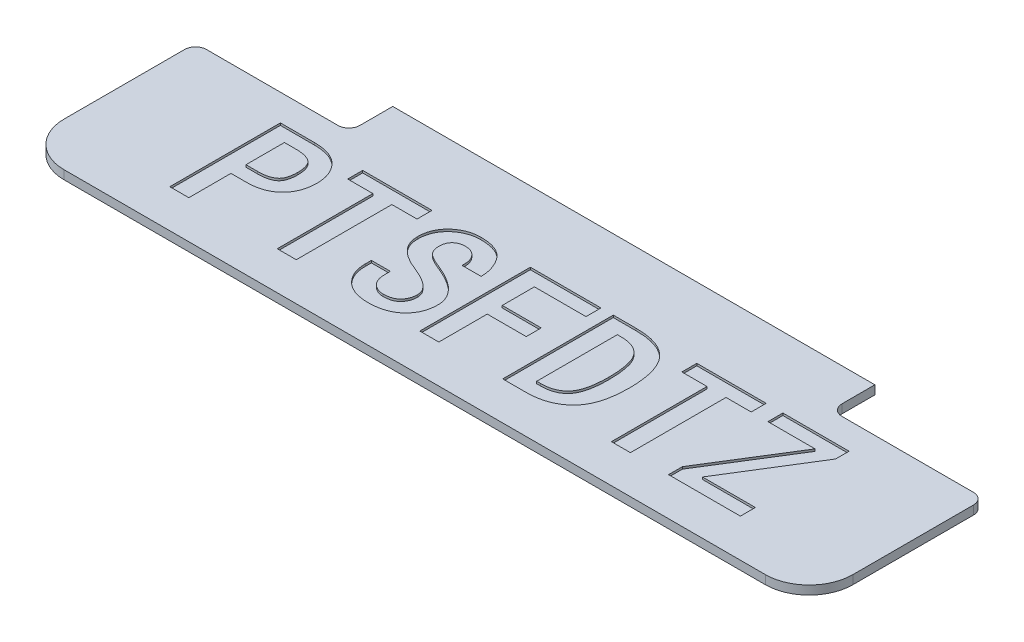
from build123d import *

# Parameters (mm, degrees)
SKETCH_1_W          = 360
SKETCH_1_H          = 100
EXTRUDE_1_DEPTH     = 4
FILLET_3_R          = 20
SKETCH_4_W          = 70
SKETCH_4_H          = 20
CUT_EXTRUDE_2_DEPTH = 6
FILLET_5_R          = 5
CUT_EXTRUDE_3_DEPTH = 1


with BuildPart() as part:
    # 草图1 → 凸台-拉伸1 (new body)
    with BuildSketch(Plane(origin=(0, 0, 0), x_dir=(1, 0, 0), z_dir=(0, 1, 0))):
        Rectangle(SKETCH_1_W, SKETCH_1_H)
    extrude(amount=EXTRUDE_1_DEPTH)

    # 圆角3
    fillet_3_edges = [part.edges().sort_by_distance(p)[0] for p in [
        (180, 2, 50),
        (-180, 2, 50),
    ]]
    fillet(fillet_3_edges, radius=FILLET_3_R)

    # 草图4 → 切除-拉伸2 (cut)
    with BuildSketch(Plane(origin=(0, 4, 0), x_dir=(1, 0, 0), z_dir=(0, 1, 0))):
        with Locations((-145, 40)):
            Rectangle(SKETCH_4_W, SKETCH_4_H)
        with Locations((145, 40)):
            Rectangle(SKETCH_4_W, SKETCH_4_H)
    extrude(amount=-CUT_EXTRUDE_2_DEPTH, mode=Mode.SUBTRACT)

    # 圆角5
    fillet_5_edges = [part.edges().sort_by_distance(p)[0] for p in [
        (-180, 2, -30),
        (-110, 2, -30),
        (180, 2, -30),
        (110, 2, -30),
    ]]
    fillet(fillet_5_edges, radius=FILLET_5_R)

    # 草图5 → 切除-拉伸3 (cut)
    # profile 1 of 7: a face of its own
    with BuildSketch(Plane(origin=(0, 4, 0), x_dir=(1, 0, 0), z_dir=(0, 1, 0))):
        with BuildLine():
            add(Edge.make_bspline(
                [(-96.930323036, 2.246131172), (-96.941240629, 1.678684399), (-96.96266472, 0.565157745), (-97.176776831, -1.061394982), (-97.505462245, -2.608479804), (-97.98565937, -4.066112037), (-98.596740714, -5.440103135), (-99.332362717, -6.737618495), (-100.219971253, -7.946795483), (-101.234618973, -9.069444095), (-102.368729992, -10.089994066), (-103.625112767, -10.975780061), (-105.002393633, -11.713498841), (-106.491977603, -12.317723659), (-108.090281346, -12.797421108), (-109.803032757, -13.125823637), (-111.624251111, -13.33843239), (-112.878002094, -13.359342717), (-113.521182902, -13.370069824)],
                knots=[0, 0, 0, 0, 1.055941234, 2.072121589, 3.048957332, 3.996857081, 4.923552649, 5.844699312, 6.768221172, 7.710385292, 8.657546142, 9.602916946, 10.565193964, 11.559900134, 12.591170482, 13.666713964, 14.803012066, 16, 16, 16, 16], degree=3))
            Line((-113.521182902, -13.370069824), (-120.462919961, -13.370069824))
            Line((-120.462919961, -13.370069824), (-120.462919961, -32.592508637))
            Line((-120.462919961, -32.592508637), (-129.137383898, -32.592508637))
            Line((-129.137383898, -32.592508637), (-129.137383898, 17.862332169))
            Line((-129.137383898, 17.862332169), (-113.521182902, 17.862332169))
            add(Edge.make_bspline(
                [(-113.521182902, 17.862332169), (-112.878003272, 17.851599948), (-111.624254585, 17.830679652), (-109.803019969, 17.618141502), (-108.09032574, 17.289490706), (-106.495026175, 16.811623682), (-105.007492565, 16.205379927), (-103.638895039, 15.455481786), (-102.379093591, 14.572185043), (-101.245782364, 13.550553913), (-100.229942247, 12.428757076), (-99.345164183, 11.215836106), (-98.594528876, 9.924880554), (-97.986491053, 8.547075866), (-97.50514227, 7.090054296), (-97.177954655, 5.546253541), (-96.961981277, 3.923602488), (-96.941032746, 2.81360526), (-96.930323036, 2.246131172)],
                knots=[0, 0, 0, 0, 1.197461093, 2.334208364, 3.410176999, 4.441854999, 5.43073401, 6.396602736, 7.342347237, 8.289882492, 9.232419041, 10.156305961, 11.081170954, 12.008232837, 12.956507283, 13.93372916, 14.943641362, 16, 16, 16, 16], degree=3))
        make_face()
        with BuildLine():
            add(Edge.make_bspline(
                [(-105.604786974, 2.246131172), (-105.608479009, 2.654402128), (-105.615586774, 3.440389753), (-105.74000997, 4.565658318), (-105.921952585, 5.590312848), (-106.163632167, 6.520265524), (-106.498542772, 7.346972328), (-106.911355072, 8.067721896), (-107.392572268, 8.68895261), (-107.958276189, 9.203679491), (-108.596197591, 9.644126638), (-109.320196509, 10.004636761), (-110.109190682, 10.33467643), (-110.984231452, 10.593521207), (-111.938380749, 10.782748108), (-112.969188934, 10.922167488), (-114.079224844, 11.009640612), (-114.845829419, 11.022320093), (-115.243080238, 11.02889054)],
                knots=[0, 0, 0, 0, 1.287087184, 2.477851002, 3.56551051, 4.568137571, 5.502703185, 6.369845782, 7.180743627, 7.970419851, 8.772637866, 9.617977299, 10.516617182, 11.467615524, 12.490341929, 13.582105939, 14.747058877, 16, 16, 16, 16], degree=3))
            Line((-115.243080238, 11.02889054), (-120.462919961, 11.02889054))
            Line((-120.462919961, 11.02889054), (-120.462919961, -6.525798652))
            Line((-120.462919961, -6.525798652), (-115.243080238, -6.525798652))
            add(Edge.make_bspline(
                [(-115.243080238, -6.525798652), (-114.845843204, -6.519089154), (-114.075666273, -6.506080545), (-112.961866286, -6.419881298), (-111.927708071, -6.27923904), (-110.972883976, -6.091675669), (-110.101399993, -5.827815777), (-109.308892751, -5.517989078), (-108.594602843, -5.147831409), (-107.958004675, -4.71198757), (-107.392646525, -4.19653426), (-106.911333451, -3.575504976), (-106.49854923, -2.854696417), (-106.163630243, -2.028007222), (-105.921953164, -1.098049287), (-105.740009794, -0.073396344), (-105.615586824, 1.051872697), (-105.608479026, 1.837860252), (-105.604786974, 2.246131172)],
                knots=[0, 0, 0, 0, 1.253177668, 2.4297043, 3.521674426, 4.544593913, 5.495771796, 6.390314524, 7.225705931, 8.028075398, 8.817900706, 9.628951643, 10.496257949, 11.431000001, 12.433816351, 13.5216812, 14.712669824, 16, 16, 16, 16], degree=3))
        make_face(mode=Mode.SUBTRACT)
    # profile 2 of 7: a face of its own
    with BuildSketch(Plane(origin=(0, 4, 0), x_dir=(1, 0, 0), z_dir=(0, 1, 0))):
        Polygon((-59.958263257, 11.02889054), (-71.43757883, 11.02889054), (-71.43757883, -32.592508637), (-80.112042768, -32.592508637), (-80.112042768, 11.02889054), (-91.591358341, 11.02889054), (-91.591358341, 17.862332169), (-59.958263257, 17.862332169), align=None)
    # profile 3 of 7: a face of its own
    with BuildSketch(Plane(origin=(0, 4, 0), x_dir=(1, 0, 0), z_dir=(0, 1, 0))):
        with BuildLine():
            add(Edge.make_bspline(
                [(-21.264306142, -18.124239198), (-21.273942185, -18.670203663), (-21.292785304, -19.737828041), (-21.524188395, -21.298871293), (-21.861614883, -22.784956854), (-22.351305653, -24.196353136), (-22.994195676, -25.518653167), (-23.772261434, -26.766195963), (-24.681901145, -27.939562717), (-25.733937606, -29.018500765), (-26.903278539, -30.001283907), (-28.201642194, -30.839704293), (-29.591215948, -31.576333049), (-31.098322009, -32.15724378), (-32.708143205, -32.612697496), (-34.426239213, -32.933302623), (-36.251330092, -33.131779438), (-37.504485595, -33.154708155), (-38.147563669, -33.166474416)],
                knots=[0, 0, 0, 0, 1.026257907, 2.006830171, 2.962246814, 3.890064445, 4.810370876, 5.722421915, 6.651580647, 7.597683975, 8.552400441, 9.518664622, 10.499801109, 11.506160626, 12.550923594, 13.643079996, 14.790506386, 16, 16, 16, 16], degree=3))
            add(Edge.make_bspline(
                [(-38.147563669, -33.166474416), (-38.754490988, -33.154387605), (-39.935545147, -33.130867197), (-41.65819074, -32.937070221), (-43.275252559, -32.59598589), (-44.801054893, -32.151360285), (-46.217371414, -31.547417728), (-47.534994213, -30.823462052), (-48.746376097, -29.9594001), (-49.846463398, -28.975373729), (-50.83277911, -27.893044046), (-51.686933782, -26.731734972), (-52.422875002, -25.50947441), (-53.019030361, -24.220552753), (-53.473696183, -22.860492018), (-53.812960537, -21.441159268), (-54.008802954, -19.949085433), (-54.033014207, -18.93340863), (-54.045332783, -18.416636859)],
                knots=[0, 0, 0, 0, 1.193018561, 2.321562216, 3.40162537, 4.438920661, 5.44067282, 6.422236786, 7.389118855, 8.359199127, 9.318734736, 10.262632676, 11.188836767, 12.119191402, 13.04830011, 14.003653799, 14.984268067, 16, 16, 16, 16], degree=3))
            Line((-54.045332783, -18.416636859), (-54.045332783, -15.709251111))
            Line((-54.045332783, -15.709251111), (-45.370868845, -15.709251111))
            Line((-45.370868845, -15.709251111), (-45.370868845, -18.124239198))
            add(Edge.make_bspline(
                [(-45.370868845, -18.124239198), (-45.366219552, -18.463949207), (-45.357191946, -19.123569512), (-45.242149758, -20.078631662), (-45.080069313, -20.966461348), (-44.821723333, -21.77959545), (-44.513994553, -22.52696569), (-44.130437521, -23.20814618), (-43.676578574, -23.821255734), (-42.971849101, -24.508945036), (-42.02012446, -25.229235066), (-40.791778858, -25.86696805), (-39.488294789, -26.256272423), (-38.597773762, -26.307257081), (-38.147563669, -26.333032787)],
                knots=[0, 0, 0, 0, 0.994138789, 1.93033503, 2.813467417, 3.632600764, 4.423770476, 5.176361867, 5.916301246, 6.64880386, 8.052580935, 9.395208834, 10.683126801, 12, 12, 12, 12], degree=3))
            add(Edge.make_bspline(
                [(-38.147563669, -26.333032787), (-37.804317035, -26.328129172), (-37.137640251, -26.318605041), (-36.174364766, -26.207354579), (-35.280091554, -26.034064703), (-34.455072926, -25.805089077), (-33.71095066, -25.482060701), (-33.031356162, -25.108092549), (-32.432269434, -24.645153577), (-31.727244802, -23.953949626), (-31.012480898, -22.963823537), (-30.378213161, -21.649498507), (-30.001065909, -20.209826606), (-29.959837657, -19.20941425), (-29.93877008, -18.698204977)],
                knots=[0, 0, 0, 0, 0.971428041, 1.886773118, 2.740655993, 3.54930072, 4.30485501, 5.032520431, 5.739803091, 6.440855371, 7.82273612, 9.171295201, 10.55453592, 12, 12, 12, 12], degree=3))
            add(Edge.make_bspline(
                [(-29.93877008, -18.698204977), (-29.968551673, -18.271854585), (-30.029038908, -17.405925228), (-30.519281631, -16.144673783), (-31.301302223, -14.936521926), (-32.388015809, -13.769752332), (-33.787835247, -12.643572067), (-35.505267235, -11.542920082), (-37.54539183, -10.461887299), (-39.044706187, -9.820948256), (-39.836972376, -9.482263889)],
                knots=[0, 0, 0, 0, 0.715380919, 1.452958298, 2.244527468, 3.125416911, 4.121977031, 5.258627686, 6.551406792, 8, 8, 8, 8], degree=3))
            add(Edge.make_bspline(
                [(-39.836972376, -9.482263889), (-40.383458047, -9.26913759), (-41.443564014, -8.855702301), (-42.967966672, -8.195112705), (-44.37895528, -7.503822059), (-45.672937763, -6.778320363), (-46.86464898, -6.042976963), (-47.936179726, -5.276424108), (-48.893961306, -4.482524435), (-49.746833307, -3.669658357), (-50.490246507, -2.818037141), (-51.133485162, -1.92689627), (-51.674852727, -0.993410674), (-52.124491632, -0.022924952), (-52.470956729, 0.989825975), (-52.723683858, 2.044311122), (-52.860986835, 3.141373985), (-52.885173571, 3.88465761), (-52.897401226, 4.260426169)],
                knots=[0, 0, 0, 0, 1.385538574, 2.687751546, 3.923348175, 5.095308518, 6.190818142, 7.229672453, 8.204653253, 9.127369857, 10.009763995, 10.871183968, 11.719462109, 12.555044509, 13.393710489, 14.24378683, 15.112142833, 16, 16, 16, 16], degree=3))
            add(Edge.make_bspline(
                [(-52.897401226, 4.260426169), (-52.886454192, 4.777361021), (-52.86507987, 5.786687656), (-52.652758061, 7.263788152), (-52.306726186, 8.663860854), (-51.830827947, 9.990085458), (-51.219274021, 11.243434711), (-50.455463033, 12.411756046), (-49.562840744, 13.511602711), (-48.546769199, 14.523770304), (-47.437313506, 15.43589908), (-46.267198444, 16.244030504), (-45.034806428, 16.917532263), (-43.754250401, 17.46932601), (-42.426024051, 17.909987586), (-41.042385537, 18.207843826), (-39.611208425, 18.397831348), (-38.639106692, 18.42337952), (-38.147563669, 18.436297947)],
                knots=[0, 0, 0, 0, 1.0851237, 2.118727819, 3.126397254, 4.109670587, 5.07262421, 6.048386153, 7.034723786, 8.042592853, 9.055070971, 10.047653608, 11.024857746, 11.999470295, 12.972873042, 13.958860951, 14.967898497, 16, 16, 16, 16], degree=3))
            add(Edge.make_bspline(
                [(-38.147563669, 18.436297947), (-37.475397218, 18.423122146), (-36.177484802, 18.397680478), (-34.307849825, 18.164702903), (-32.582949501, 17.802969369), (-31.005513159, 17.289065781), (-29.580153546, 16.609843247), (-28.30102037, 15.789146088), (-27.185556035, 14.79886304), (-26.223356612, 13.678118583), (-25.405076782, 12.463885502), (-24.671503312, 11.2203788), (-24.062433435, 9.932490984), (-23.566393364, 8.613050497), (-23.171841297, 7.259649589), (-22.888632411, 5.869424168), (-22.725558213, 4.441248045), (-22.704422773, 3.477492518), (-22.693805817, 2.993369639)],
                knots=[0, 0, 0, 0, 1.302674875, 2.515385722, 3.646489207, 4.715455019, 5.72345844, 6.699892586, 7.651918048, 8.604612122, 9.55583978, 10.487320937, 11.401445266, 12.313960692, 13.217630151, 14.13175448, 15.061525072, 16, 16, 16, 16], degree=3))
            Line((-22.693805817, 2.993369639), (-31.379099298, 2.993369639))
            add(Edge.make_bspline(
                [(-31.379099298, 2.993369639), (-31.355596352, 3.571639179), (-31.310527994, 4.680506943), (-31.564195838, 6.282469716), (-32.079428011, 7.730142868), (-32.758807563, 8.777231008), (-33.388599049, 9.519906431), (-33.923675882, 10.001689483), (-34.514905855, 10.399677767), (-35.141254716, 10.743129567), (-35.826312276, 10.989768814), (-36.555446907, 11.172023557), (-37.334615821, 11.298673885), (-37.872697669, 11.306474105), (-38.147563669, 11.310458658)],
                knots=[0, 0, 0, 0, 1.697450499, 3.254966772, 4.735083127, 6.180148285, 6.894731882, 7.593387837, 8.287842769, 8.985531501, 9.687081119, 10.420398074, 11.193098849, 12, 12, 12, 12], degree=3))
            add(Edge.make_bspline(
                [(-38.147563669, 11.310458658), (-38.578997072, 11.293589783), (-39.409378446, 11.261122201), (-40.592815348, 10.959952138), (-41.651241623, 10.46909236), (-42.575977679, 9.781491528), (-43.329960542, 8.890655588), (-43.853154833, 7.790806837), (-44.167634219, 6.512227057), (-44.203844172, 5.598014468), (-44.222937288, 5.115960066)],
                knots=[0, 0, 0, 0, 1.050820751, 2.022518361, 2.956085645, 3.88064, 4.811878975, 5.772744392, 6.825592226, 8, 8, 8, 8], degree=3))
            add(Edge.make_bspline(
                [(-44.222937288, 5.115960066), (-44.208173599, 4.71011807), (-44.179473882, 3.921185829), (-43.903672419, 2.793703578), (-43.448097142, 1.778057884), (-42.932909738, 0.998360099), (-42.356361435, 0.430730987), (-41.782516942, -0.018747563), (-41.054769735, -0.481249762), (-40.194517353, -0.979386237), (-39.178458596, -1.480258491), (-38.035688711, -2.026698624), (-36.737547784, -2.574540743), (-35.823368694, -2.942622067), (-35.342712033, -3.136151695)],
                knots=[0, 0, 0, 0, 1.115479074, 2.168423712, 3.169032593, 4.169296207, 4.71721719, 5.389015533, 6.171560352, 7.088321403, 8.123495142, 9.287804716, 10.573983217, 12, 12, 12, 12], degree=3))
            add(Edge.make_bspline(
                [(-35.342712033, -3.136151695), (-34.7846161, -3.369462243), (-33.694636417, -3.825125403), (-32.131616033, -4.576791593), (-30.672728498, -5.354766901), (-29.307594227, -6.154505123), (-28.055508096, -7.002243191), (-26.894916269, -7.864513107), (-25.833310973, -8.755872145), (-24.884669568, -9.685521572), (-24.031293545, -10.63966985), (-23.295726954, -11.627474464), (-22.658392439, -12.636288462), (-22.148682817, -13.679051042), (-21.754926641, -14.750258608), (-21.474473167, -15.849587605), (-21.292330359, -16.977458983), (-21.273673863, -17.740902294), (-21.264306142, -18.124239198)],
                knots=[0, 0, 0, 0, 1.329306622, 2.596179482, 3.810071124, 4.96256867, 6.071617761, 7.131592304, 8.139326642, 9.115555021, 10.048526088, 10.949822194, 11.819411578, 12.667452081, 13.495778931, 14.323231398, 15.158068091, 16, 16, 16, 16], degree=3))
        make_face()
    # profile 4 of 7: a face of its own
    with BuildSketch(Plane(origin=(0, 4, 0), x_dir=(1, 0, 0), z_dir=(0, 1, 0))):
        Polygon((17.148082855, 11.02889054), (-6.384514069, 11.02889054), (-6.384514069, -3.655969759), (11.408425069, -3.655969759), (11.408425069, -10.500240931), (-6.384514069, -10.500240931), (-6.384514069, -32.592508637), (-15.06980755, -32.592508637), (-15.06980755, 17.862332169), (17.148082855, 17.862332169), align=None)
    # profile 5 of 7: a face of its own
    with BuildSketch(Plane(origin=(0, 4, 0), x_dir=(1, 0, 0), z_dir=(0, 1, 0))):
        with BuildLine():
            add(Edge.make_bspline(
                [(55.268074191, -7.511287065), (55.248404328, -8.580304935), (55.210393217, -10.646133115), (54.947325647, -13.63019612), (54.479642023, -16.380482744), (53.853215057, -18.908870895), (53.018663477, -21.207146032), (52.001776729, -23.276255934), (50.805904009, -25.122849988), (49.407972612, -26.72527075), (47.839165919, -28.100395689), (46.159960972, -29.315436), (44.329987178, -30.32346589), (42.374735381, -31.166624847), (40.271310855, -31.79491969), (38.041468495, -32.266988686), (35.673037524, -32.533346353), (34.05002759, -32.572476094), (33.219124657, -32.592508637)],
                knots=[0, 0, 0, 0, 1.342144575, 2.593633054, 3.756717374, 4.841651051, 5.859627, 6.82036316, 7.730462365, 8.613865072, 9.480661094, 10.344703869, 11.211025818, 12.098326216, 13.012995588, 13.962311034, 14.956801371, 16, 16, 16, 16], degree=3))
            Line((33.219124657, -32.592508637), (22.768615669, -32.592508637))
            Line((22.768615669, -32.592508637), (22.768615669, 17.862332169))
            Line((22.768615669, 17.862332169), (33.219124657, 17.862332169))
            add(Edge.make_bspline(
                [(33.219124657, 17.862332169), (34.140345738, 17.843741106), (35.925950285, 17.807706016), (38.509937753, 17.52762649), (40.902628449, 17.054760409), (43.10355585, 16.397500206), (45.116215997, 15.551673828), (46.939597926, 14.510302854), (48.566197222, 13.266573162), (50.003707308, 11.827672825), (51.263967003, 10.184518149), (52.332954329, 8.309058383), (53.254465667, 6.22388288), (54.000835267, 3.908035824), (54.563738584, 1.368712965), (54.970163864, -1.39269662), (55.22039727, -4.376954069), (55.251813068, -6.442263029), (55.268074191, -7.511287065)],
                knots=[0, 0, 0, 0, 1.139218849, 2.20815003, 3.209846182, 4.151949686, 5.044228713, 5.904257272, 6.741881979, 7.569029454, 8.412913495, 9.295104618, 10.232584117, 11.227981957, 12.299195142, 13.445861256, 14.677952907, 16, 16, 16, 16], degree=3))
        make_face()
        with BuildLine():
            add(Edge.make_bspline(
                [(46.301212593, -7.511287065), (46.291000271, -6.677150947), (46.271397388, -5.075999555), (46.118374465, -2.773738153), (45.877979352, -0.667803227), (45.52588871, 1.244719031), (45.062523944, 2.961983698), (44.505871003, 4.485165714), (43.847913503, 5.815245372), (43.0684308, 6.948068103), (42.184174018, 7.913005454), (41.216379384, 8.758185991), (40.133264912, 9.466330851), (38.945441147, 10.040005343), (37.658498102, 10.485741332), (36.270284487, 10.794093019), (34.780846245, 10.995522922), (33.750466978, 11.017537922), (33.219124657, 11.02889054)],
                knots=[0, 0, 0, 0, 1.535002912, 2.946487986, 4.244348877, 5.43397676, 6.521824758, 7.513996585, 8.414230777, 9.245329631, 10.035428857, 10.817273383, 11.604069902, 12.409274804, 13.239177928, 14.104616871, 15.02259556, 16, 16, 16, 16], degree=3))
            Line((33.219124657, 11.02889054), (31.443079606, 11.02889054))
            Line((31.443079606, 11.02889054), (31.443079606, -25.759067008))
            Line((31.443079606, -25.759067008), (33.219124657, -25.759067008))
            add(Edge.make_bspline(
                [(33.219124657, -25.759067008), (33.750380901, -25.746782824), (34.780135712, -25.722971908), (36.273013276, -25.534000681), (37.665673305, -25.239513436), (38.950439588, -24.802910496), (40.135340479, -24.249724437), (41.212694512, -23.560817687), (42.194101437, -22.756983712), (43.078096599, -21.819694427), (43.861403657, -20.718048874), (44.5163685, -19.41544245), (45.061704721, -17.914695998), (45.528145462, -16.221114092), (45.877567575, -14.322208239), (46.118555404, -12.227246333), (46.271372093, -9.935743954), (46.290990413, -8.34181054), (46.301212593, -7.511287065)],
                knots=[0, 0, 0, 0, 0.985268004, 1.909783609, 2.787259994, 3.621665962, 4.421521346, 5.207376589, 5.987676396, 6.769383106, 7.590706022, 8.48624322, 9.465232296, 10.548914331, 11.741531606, 13.043184133, 14.459342799, 16, 16, 16, 16], degree=3))
        make_face(mode=Mode.SUBTRACT)
    # profile 6 of 7: a face of its own
    with BuildSketch(Plane(origin=(0, 4, 0), x_dir=(1, 0, 0), z_dir=(0, 1, 0))):
        Polygon((92.521702088, 11.02889054), (81.042386515, 11.02889054), (81.042386515, -32.592508637), (72.367922578, -32.592508637), (72.367922578, 11.02889054), (60.888607005, 11.02889054), (60.888607005, 17.862332169), (92.521702088, 17.862332169), align=None)
    # profile 7 of 7: a face of its own
    with BuildSketch(Plane(origin=(0, 4, 0), x_dir=(1, 0, 0), z_dir=(0, 1, 0))):
        Polygon((131.215659203, -32.592508637), (98.434632563, -32.592508637), (98.434632563, -26.257225986), (121.674831826, 11.02889054), (100.156529899, 11.02889054), (100.156529899, 17.862332169), (130.360125307, 17.862332169), (130.360125307, 11.711151748), (107.1090965, -25.759067008), (131.215659203, -25.759067008), align=None)
    extrude(amount=-CUT_EXTRUDE_3_DEPTH, mode=Mode.SUBTRACT)


solid = part.part
